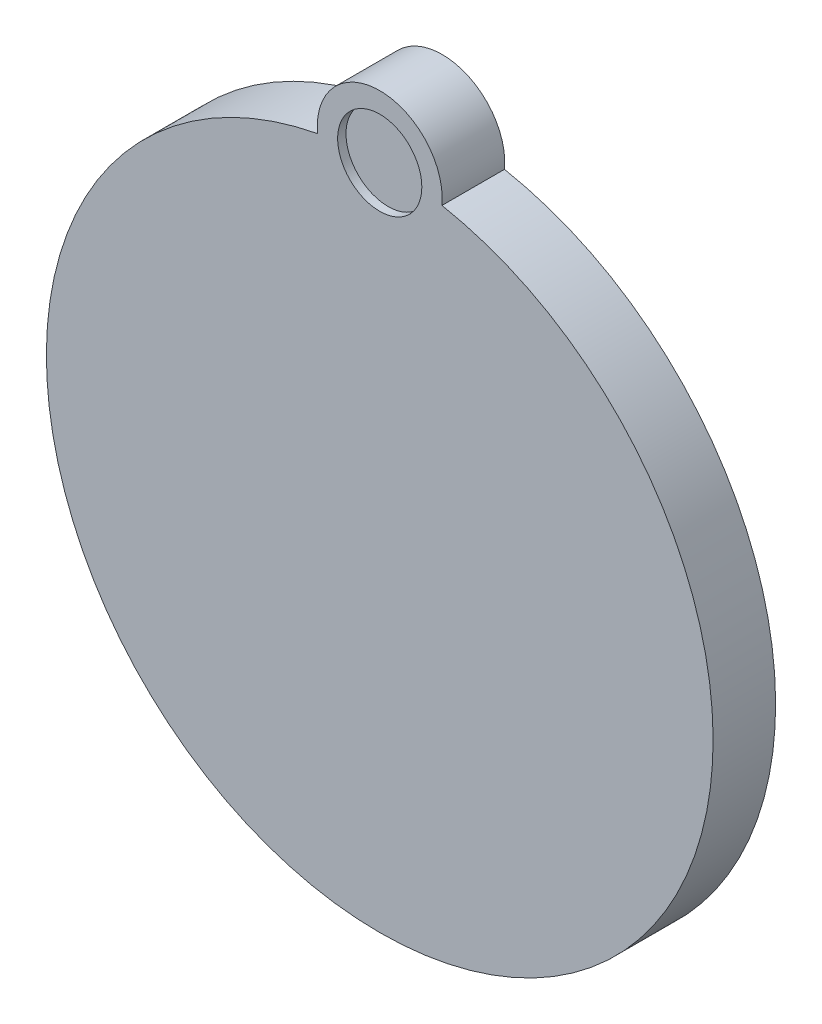
from build123d import *

# Parameters (mm, degrees)
EXTRUDE_1_DEPTH     = 15
SKETCH_10_R         = 10.1
CUT_EXTRUDE_3_DEPTH = 2


with BuildPart() as part:
    # ｽｹｯﾁ4 → ﾎﾞｽ - 押し出し1 (new body)
    with BuildSketch(Plane.XY):
        with BuildLine():
            ThreePointArc((14.933936552, -1.40625), (0, 15), (-14.933936552, -1.40625))
            ThreePointArc((-14.933936552, -1.40625), (0, -160), (14.933936552, -1.40625))
        make_face()
    extrude(amount=EXTRUDE_1_DEPTH)

    # ｽｹｯﾁ10 → ｶｯﾄ - 押し出し3 (cut)
    with BuildSketch(Plane.XY.offset(15)):
        Circle(SKETCH_10_R)
    extrude(amount=-CUT_EXTRUDE_3_DEPTH, mode=Mode.SUBTRACT)


solid = part.part
